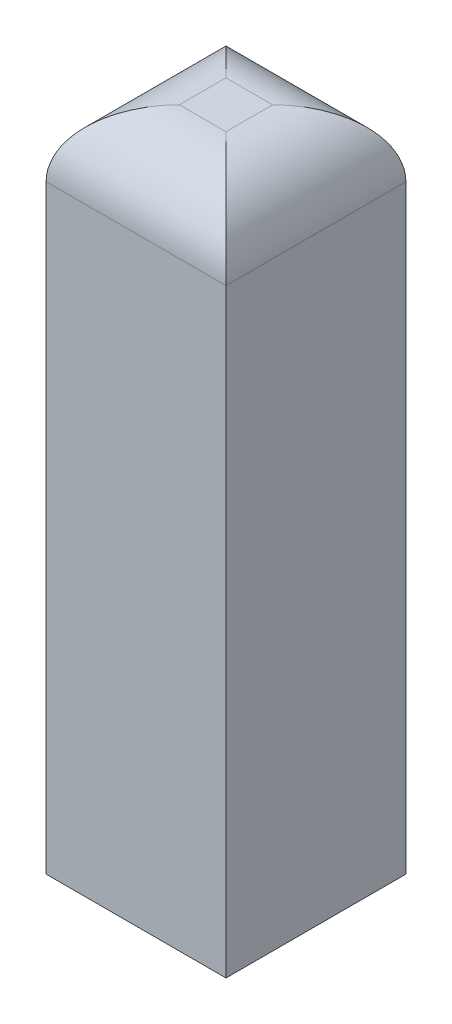
from build123d import *

# Parameters (mm, degrees)
SKETCH1_W           = 2.7
SKETCH1_H           = 2.7
BOSS_EXTRUDE1_DEPTH = 10
FILLET1_R           = 1


with BuildPart() as part:
    # Sketch1 → Boss-Extrude1 (new body)
    with BuildSketch(Plane(origin=(0, 0, 0), x_dir=(1, 0, 0), z_dir=(0, 1, 0))):
        Rectangle(SKETCH1_W, SKETCH1_H)
    extrude(amount=BOSS_EXTRUDE1_DEPTH)

    # Fillet1
    fillet1_edges = [part.edges().sort_by_distance(p)[0] for p in [
        (-1.35, 10, 0),
        (0, 10, 1.35),
        (1.35, 10, 0),
        (0, 10, -1.35),
    ]]
    fillet(fillet1_edges, radius=FILLET1_R)


solid = part.part
